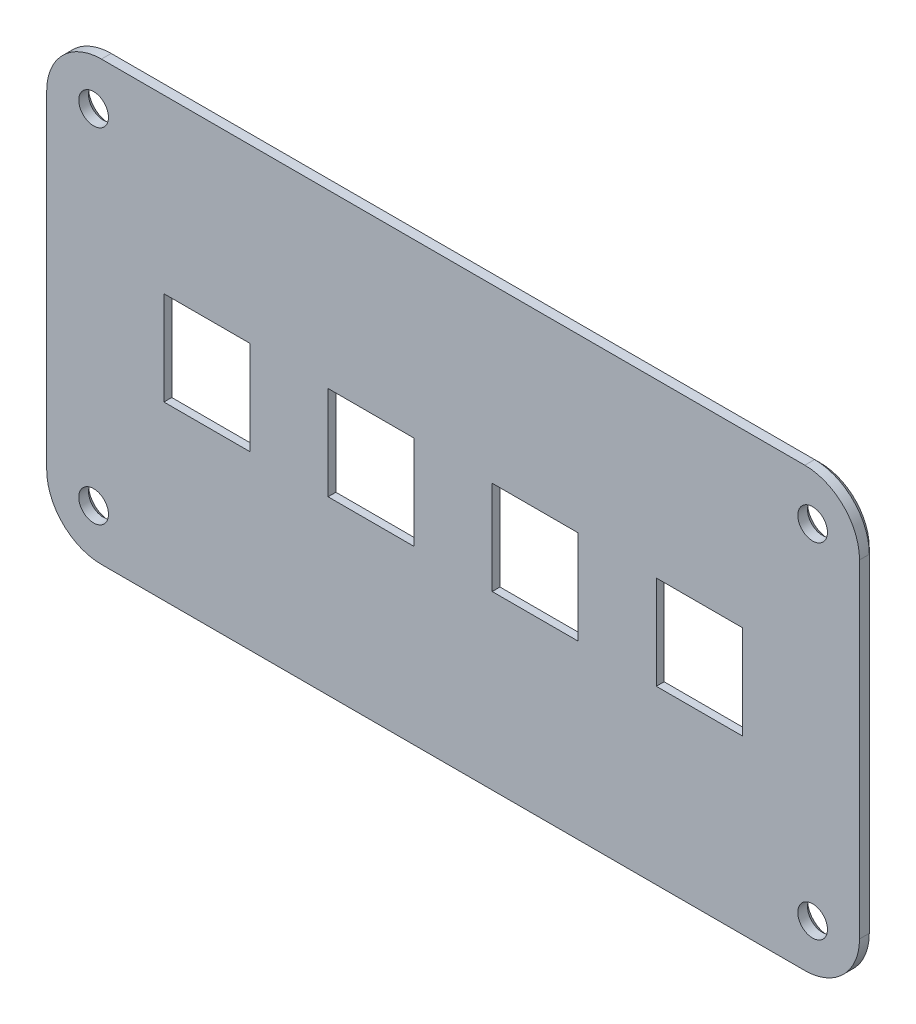
from build123d import *

# Parameters (mm, degrees)
SKETCH1_R           = 1.9
BOSS_EXTRUDE1_DEPTH = 2
CUT_EXTRUDE1_REACH  = 61.093
SKETCH2_W           = 11
SKETCH2_H           = 12
CHAMFER1_SIZE       = 1
BOSS_EXTRUDE2_DEPTH = 1
CHAMFER2_SIZE       = 0.75


with BuildPart() as part:
    # Sketch1 → Boss-Extrude1 (new body)
    with BuildSketch(Plane.XY):
        with BuildLine():
            Line((-52, 21), (-52, -21))
            ThreePointArc((-52, -21), (-49.949747468, -25.949747468), (-45, -28))
            Line((-45, -28), (45, -28))
            ThreePointArc((45, -28), (49.949747468, -25.949747468), (52, -21))
            Line((52, -21), (52, 21))
            ThreePointArc((52, 21), (49.949747468, 25.949747468), (45, 28))
            Line((45, 28), (-45, 28))
            ThreePointArc((-45, 28), (-49.949747468, 25.949747468), (-52, 21))
        make_face()
        with Locations((-46, 22)):
            Circle(SKETCH1_R, mode=Mode.SUBTRACT)
        with Locations((46, 22)):
            Circle(SKETCH1_R, mode=Mode.SUBTRACT)
        with Locations((46, -22)):
            Circle(SKETCH1_R, mode=Mode.SUBTRACT)
        with Locations(Location((-46, -22, 0), (0, 0, 180))):
            Circle(SKETCH1_R, mode=Mode.SUBTRACT)
    extrude(amount=BOSS_EXTRUDE1_DEPTH)

    # Sketch2 → Cut-Extrude1 (cut, up to next)
    with BuildSketch(Plane(origin=(0, 0, 0), x_dir=(-1, 0, 0), z_dir=(0, 0, -1)), mode=Mode.PRIVATE) as cut_extrude1_sk1:
        with Locations((-31.5, 0)):
            Rectangle(SKETCH2_W, SKETCH2_H)
    cut_extrude1_tool1 = extrude(cut_extrude1_sk1.sketch, amount=-CUT_EXTRUDE1_REACH, mode=Mode.PRIVATE) & part.part
    # Sketch2 → Cut-Extrude1 (cut, up to next)
    with BuildSketch(Plane(origin=(0, 0, 0), x_dir=(-1, 0, 0), z_dir=(0, 0, -1)), mode=Mode.PRIVATE) as cut_extrude1_sk2:
        with Locations((-10.5, 0)):
            Rectangle(SKETCH2_W, SKETCH2_H)
    cut_extrude1_tool2 = extrude(cut_extrude1_sk2.sketch, amount=-CUT_EXTRUDE1_REACH, mode=Mode.PRIVATE) & part.part
    # Sketch2 → Cut-Extrude1 (cut, up to next)
    with BuildSketch(Plane(origin=(0, 0, 0), x_dir=(-1, 0, 0), z_dir=(0, 0, -1)), mode=Mode.PRIVATE) as cut_extrude1_sk3:
        with Locations((10.5, 0)):
            Rectangle(SKETCH2_W, SKETCH2_H)
    cut_extrude1_tool3 = extrude(cut_extrude1_sk3.sketch, amount=-CUT_EXTRUDE1_REACH, mode=Mode.PRIVATE) & part.part
    # Sketch2 → Cut-Extrude1 (cut, up to next)
    with BuildSketch(Plane(origin=(0, 0, 0), x_dir=(-1, 0, 0), z_dir=(0, 0, -1)), mode=Mode.PRIVATE) as cut_extrude1_sk4:
        with Locations((31.5, 0)):
            Rectangle(SKETCH2_W, SKETCH2_H)
    cut_extrude1_tool4 = extrude(cut_extrude1_sk4.sketch, amount=-CUT_EXTRUDE1_REACH, mode=Mode.PRIVATE) & part.part
    add(cut_extrude1_tool1.solids().sort_by_distance((31.5, 0, 0))[0], mode=Mode.SUBTRACT)
    add(cut_extrude1_tool2.solids().sort_by_distance((10.5, 0, 0))[0], mode=Mode.SUBTRACT)
    add(cut_extrude1_tool3.solids().sort_by_distance((-10.5, 0, 0))[0], mode=Mode.SUBTRACT)
    add(cut_extrude1_tool4.solids().sort_by_distance((-31.5, 0, 0))[0], mode=Mode.SUBTRACT)

    # Chamfer1
    chamfer1_edges = [part.edges().sort_by_distance(p)[0] for p in [
        (26, 0, 0),
        (31.5, 6, 0),
        (37, 0, 0),
        (31.5, -6, 0),
        (5, 0, 0),
        (10.5, 6, 0),
        (16, 0, 0),
        (10.5, -6, 0),
        (-16, 0, 0),
        (-10.5, 6, 0),
        (-5, 0, 0),
        (-10.5, -6, 0),
        (-37, 0, 0),
        (-31.5, 6, 0),
        (-26, 0, 0),
        (-31.5, -6, 0),
    ]]
    chamfer(chamfer1_edges, length=CHAMFER1_SIZE)

    # Sketch3 → Boss-Extrude2 (add)
    # profile 1 of 4: a face of its own
    with BuildSketch(Plane(origin=(0, 0, 0), x_dir=(-1, 0, 0), z_dir=(0, 0, -1))):
        Polygon((-28.967105263, 13.376644737), (-33.866365132, 13.376644737), (-34.939555921, 11), (-36.711759868, 11), (-32.244243421, 21.131578947), (-30.574835526, 21.131578947), (-26.078536184, 11), (-27.893914474, 11), align=None)
        Polygon((-29.499588816, 14.815789474), (-31.415707237, 19.361430921), (-33.317434211, 14.815789474), align=None, mode=Mode.SUBTRACT)
    # profile 2 of 4: a face of its own
    with BuildSketch(Plane(origin=(0, 0, 0), x_dir=(-1, 0, 0), z_dir=(0, 0, -1))):
        with BuildLine():
            add(Edge.make_bspline(
                [(-7.465460526, 16.219983553), (-7.401377429, 16.204035917), (-7.273505586, 16.172213896), (-7.089337633, 16.103759799), (-6.913457497, 16.020947798), (-6.745530286, 15.924345618), (-6.587259947, 15.809702203), (-6.434906514, 15.683159241), (-6.291869612, 15.539902226), (-6.160285298, 15.381834349), (-6.035443673, 15.215341935), (-5.93112162, 15.034201512), (-5.840424563, 14.84545415), (-5.765585394, 14.647623537), (-5.710938372, 14.439917903), (-5.669361763, 14.22366773), (-5.644410682, 13.997430988), (-5.641354143, 13.843400363), (-5.639802632, 13.765213816)],
                knots=[0, 0, 0, 0, 0.956192746, 1.907993456, 2.840752042, 3.770599473, 4.710150656, 5.668711876, 6.637605253, 7.638136089, 8.647007689, 9.648326501, 10.660904689, 11.678920621, 12.707390369, 13.768694862, 14.867380783, 16, 16, 16, 16], degree=3))
            add(Edge.make_bspline(
                [(-5.639802632, 13.765213816), (-5.642984462, 13.660176236), (-5.649215288, 13.454486206), (-5.697437192, 13.154288649), (-5.776314623, 12.871173076), (-5.892411663, 12.607183093), (-6.035057199, 12.358679101), (-6.21535012, 12.131336949), (-6.424568665, 11.919871557), (-6.665989866, 11.726854913), (-6.93777738, 11.55352289), (-7.240491942, 11.407135309), (-7.568918759, 11.277696195), (-7.928158706, 11.176788668), (-8.315676849, 11.096985237), (-8.731828949, 11.03963763), (-9.176854868, 11.007719312), (-9.482954234, 11.002624382), (-9.640625, 11)],
                knots=[0, 0, 0, 0, 0.919277724, 1.80017725, 2.654857091, 3.485266342, 4.318834452, 5.156624496, 6.017913191, 6.918436248, 7.857225575, 8.83397997, 9.857969236, 10.944245806, 12.096291106, 13.31991079, 14.619494956, 16, 16, 16, 16], degree=3))
            Line((-9.640625, 11), (-14.430921053, 11))
            Line((-14.430921053, 11), (-14.430921053, 21.131578947))
            Line((-14.430921053, 21.131578947), (-9.920230263, 21.131578947))
            add(Edge.make_bspline(
                [(-9.920230263, 21.131578947), (-9.774904028, 21.128868733), (-9.492094601, 21.12359457), (-9.07962185, 21.092626141), (-8.693424093, 21.031552144), (-8.331070212, 20.953512343), (-7.996179871, 20.847561079), (-7.683917639, 20.723799485), (-7.400442667, 20.569735489), (-7.139786095, 20.398563911), (-6.910027923, 20.204054552), (-6.706774847, 19.997126019), (-6.53523803, 19.772416379), (-6.398232396, 19.530125666), (-6.286986307, 19.274394461), (-6.212436922, 19.001520839), (-6.162400026, 18.714291644), (-6.158057427, 18.516670711), (-6.155838816, 18.415707237)],
                knots=[0, 0, 0, 0, 1.336286475, 2.600455535, 3.798999959, 4.928674438, 6.004787893, 7.025056379, 8.011676755, 8.965813923, 9.887098281, 10.773799428, 11.628191274, 12.477690323, 13.327352918, 14.185037409, 15.072745346, 16, 16, 16, 16], degree=3))
            add(Edge.make_bspline(
                [(-6.155838816, 18.415707237), (-6.159819446, 18.287905241), (-6.16760867, 18.037824685), (-6.239310355, 17.674970927), (-6.356970182, 17.335377088), (-6.521020311, 17.025450308), (-6.718166496, 16.750986955), (-6.942087647, 16.521604663), (-7.189333692, 16.337663519), (-7.373817035, 16.259040253), (-7.465460526, 16.219983553)],
                knots=[0, 0, 0, 0, 1.128919966, 2.209049493, 3.25528948, 4.296006145, 5.298287809, 6.232298465, 7.121880943, 8, 8, 8, 8], degree=3))
        make_face()
        with BuildLine():
            Line((-12.640213816, 19.692434211), (-12.640213816, 16.789473684))
            Line((-12.640213816, 16.789473684), (-10.045641447, 16.789473684))
            add(Edge.make_bspline(
                [(-10.045641447, 16.789473684), (-9.962007853, 16.790763715), (-9.80005632, 16.793261783), (-9.564579474, 16.809450721), (-9.344708527, 16.837509147), (-9.140853522, 16.878869657), (-8.95222004, 16.929819125), (-8.779015213, 16.992815234), (-8.622080932, 17.069944602), (-8.478762382, 17.155332009), (-8.353155797, 17.254902973), (-8.242677928, 17.363526411), (-8.1520415, 17.485190104), (-8.074337603, 17.614433643), (-8.01738596, 17.757164139), (-7.973692481, 17.908437022), (-7.948919342, 18.071561529), (-7.945997469, 18.183306749), (-7.944490132, 18.240953947)],
                knots=[0, 0, 0, 0, 1.388404796, 2.688564191, 3.916271261, 5.065340991, 6.138999959, 7.157663944, 8.119334074, 9.03833356, 9.921420651, 10.774159163, 11.602412025, 12.433628792, 13.270277899, 14.145414394, 15.043255143, 16, 16, 16, 16], degree=3))
            add(Edge.make_bspline(
                [(-7.944490132, 18.240953947), (-7.946093763, 18.297902157), (-7.949239462, 18.40961229), (-7.973102858, 18.572234096), (-8.017785013, 18.723277674), (-8.074411848, 18.865336618), (-8.151810643, 18.995369895), (-8.244932366, 19.115648664), (-8.355072942, 19.225054244), (-8.480855048, 19.324499499), (-8.624136811, 19.409875883), (-8.781029105, 19.487195888), (-8.95463349, 19.549439037), (-9.142518244, 19.60375075), (-9.346826473, 19.644177075), (-9.56661731, 19.672522575), (-9.801433322, 19.688578102), (-9.962695265, 19.691124469), (-10.045641447, 19.692434211)],
                knots=[0, 0, 0, 0, 0.946116285, 1.855910409, 2.720779912, 3.558079771, 4.389943065, 5.225770781, 6.07917256, 6.962946522, 7.882660813, 8.845078938, 9.864535248, 10.942101456, 12.092064941, 13.320726931, 14.6218976, 16, 16, 16, 16], degree=3))
            Line((-10.045641447, 19.692434211), (-12.640213816, 19.692434211))
        make_face(mode=Mode.SUBTRACT)
        with BuildLine():
            add(Edge.make_bspline(
                [(-9.696134868, 12.439144737), (-9.603589932, 12.440383272), (-9.424517158, 12.442779814), (-9.165229294, 12.459573871), (-8.924103577, 12.485028812), (-8.701711791, 12.524274582), (-8.497700534, 12.573391014), (-8.311764021, 12.631422903), (-8.145947716, 12.704873012), (-7.996452779, 12.785958181), (-7.865507096, 12.881775066), (-7.751903137, 12.988590094), (-7.655243428, 13.107932297), (-7.57676062, 13.240084517), (-7.517184782, 13.385863812), (-7.474655133, 13.542627639), (-7.446456107, 13.711438466), (-7.444077185, 13.828141184), (-7.442845395, 13.888569079)],
                knots=[0, 0, 0, 0, 1.458937508, 2.823017607, 4.094897181, 5.279678661, 6.380284019, 7.40190255, 8.345345489, 9.235240217, 10.078043087, 10.895820527, 11.68719234, 12.491367394, 13.310000847, 14.161896001, 15.048241914, 16, 16, 16, 16], degree=3))
            add(Edge.make_bspline(
                [(-7.442845395, 13.888569079), (-7.444226508, 13.947597883), (-7.446923663, 14.062874262), (-7.473670294, 14.230191707), (-7.519923148, 14.384736649), (-7.578775009, 14.529975789), (-7.660120394, 14.661268406), (-7.757994106, 14.782403637), (-7.873663639, 14.891374121), (-8.007278068, 14.988738259), (-8.15752608, 15.074955326), (-8.326035974, 15.148791977), (-8.510922615, 15.21228086), (-8.714416981, 15.263977169), (-8.935299334, 15.301195737), (-9.173251615, 15.330819673), (-9.428656537, 15.3464442), (-9.604970774, 15.349004917), (-9.696134868, 15.350328947)],
                knots=[0, 0, 0, 0, 0.931219401, 1.818563043, 2.663976921, 3.473549635, 4.284205487, 5.091680015, 5.925668856, 6.784537713, 7.695497676, 8.654263813, 9.683872919, 10.777831551, 11.963946699, 13.217020784, 14.561047675, 16, 16, 16, 16], degree=3))
            Line((-9.696134868, 15.350328947), (-12.640213816, 15.350328947))
            Line((-12.640213816, 15.350328947), (-12.640213816, 12.439144737))
            Line((-12.640213816, 12.439144737), (-9.696134868, 12.439144737))
        make_face(mode=Mode.SUBTRACT)
    # profile 3 of 4: a face of its own
    with BuildSketch(Plane(origin=(0, 0, 0), x_dir=(-1, 0, 0), z_dir=(0, 0, -1))):
        with BuildLine():
            add(Edge.make_bspline(
                [(11.330592105, 10.868421053), (11.206462151, 10.870091442), (10.961179726, 10.873392154), (10.598976645, 10.908794519), (10.245618049, 10.958307933), (9.901939966, 11.033666923), (9.566081897, 11.126817392), (9.24103481, 11.246113193), (8.923104501, 11.380304248), (8.617566868, 11.539384592), (8.324804729, 11.715753338), (8.045170133, 11.906721427), (7.784718789, 12.117223378), (7.539540082, 12.34167689), (7.309218059, 12.580744968), (7.098864396, 12.839042743), (6.899762424, 13.109762218), (6.722166915, 13.398005813), (6.561264251, 13.697668935), (6.422222595, 14.008543986), (6.300770074, 14.327562234), (6.208289026, 14.658570509), (6.130598657, 14.997140858), (6.078629554, 15.345654293), (6.04373978, 15.702547592), (6.040361337, 15.94371898), (6.038651316, 16.065789474)],
                knots=[0, 0, 0, 0, 1.077073096, 2.128310629, 3.156302052, 4.17250584, 5.179967175, 6.179105447, 7.175743897, 8.173411401, 9.166012089, 10.141152415, 11.110086289, 12.070013113, 13.025043404, 13.988502359, 14.959387984, 15.939865835, 16.92450304, 17.909589339, 18.894028878, 19.884327642, 20.890189678, 21.907298367, 22.940765217, 24, 24, 24, 24], degree=3))
            add(Edge.make_bspline(
                [(6.038651316, 16.065789474), (6.040381568, 16.187854869), (6.04379998, 16.429016183), (6.078397112, 16.785983239), (6.131328457, 17.13341465), (6.204691986, 17.471745528), (6.30256802, 17.799570062), (6.419271662, 18.11949854), (6.559649364, 18.429588105), (6.719512801, 18.730263252), (6.900504595, 19.016273213), (7.096247239, 19.289888619), (7.310103759, 19.546725803), (7.540930542, 19.787058803), (7.786202176, 20.013220461), (8.05075042, 20.220222983), (8.330227258, 20.414177483), (8.625851965, 20.590208206), (8.933975811, 20.748523882), (9.252359295, 20.886806343), (9.580823187, 21.000933442), (9.915846722, 21.098849152), (10.260091295, 21.173005262), (10.61334572, 21.222857326), (10.974894256, 21.258101568), (11.219485788, 21.261461955), (11.342927632, 21.263157895)],
                knots=[0, 0, 0, 0, 1.058115815, 2.090490919, 3.106525142, 4.104236408, 5.089447522, 6.070780403, 7.054826064, 8.038423107, 9.021014499, 9.987391445, 10.953622231, 11.916045052, 12.874957817, 13.843816119, 14.826191881, 15.822840885, 16.824737074, 17.828129931, 18.829814645, 19.837841812, 20.85297209, 21.87987755, 22.930004564, 24, 24, 24, 24], degree=3))
            add(Edge.make_bspline(
                [(11.342927632, 21.263157895), (11.541201573, 21.258518702), (11.930949872, 21.249399412), (12.502663234, 21.174581598), (13.0486456, 21.047850672), (13.484781947, 20.90437213), (13.819034948, 20.764407438), (14.059470015, 20.644565668), (14.292186922, 20.512904215), (14.516309176, 20.369278482), (14.730631636, 20.212847436), (14.93519461, 20.04251883), (15.132692944, 19.861085833), (15.255479253, 19.729570372), (15.317023026, 19.663651316)],
                knots=[0, 0, 0, 0, 1.616490245, 3.177544758, 4.691801435, 6.181605177, 6.915434397, 7.645230561, 8.370992775, 9.09494532, 9.814809477, 10.533218725, 11.264810103, 12, 12, 12, 12], degree=3))
            Line((15.317023026, 19.663651316), (14.186266447, 18.623355263))
            add(Edge.make_bspline(
                [(14.186266447, 18.623355263), (14.085840221, 18.71915187), (13.888459881, 18.907433035), (13.568223132, 19.152742191), (13.235855238, 19.359069515), (12.892151861, 19.5299887), (12.535545065, 19.661273242), (12.167993178, 19.756640174), (11.788114341, 19.813683433), (11.530896003, 19.820538055), (11.400493421, 19.824013158)],
                knots=[0, 0, 0, 0, 1.068128898, 2.099328572, 3.099478003, 4.076515181, 5.049911612, 6.020084275, 6.996237502, 8, 8, 8, 8], degree=3))
            add(Edge.make_bspline(
                [(11.400493421, 19.824013158), (11.318912667, 19.822056376), (11.156875264, 19.818169774), (10.916951169, 19.798626601), (10.682950598, 19.760611527), (10.454295847, 19.709213786), (10.230800994, 19.644105382), (10.013398587, 19.562831941), (9.801673849, 19.468530254), (9.59604138, 19.359732093), (9.398972143, 19.236551009), (9.212193653, 19.100328088), (9.033551784, 18.954312282), (8.867443387, 18.793267842), (8.710757703, 18.620270326), (8.564581747, 18.434717658), (8.428728811, 18.236858048), (8.303640358, 18.027499895), (8.190688407, 17.80888875), (8.093769674, 17.581215982), (8.011950574, 17.346873829), (7.943042998, 17.105538181), (7.892375478, 16.855874735), (7.855623128, 16.599133488), (7.832294938, 16.334855559), (7.828981946, 16.156298039), (7.827302632, 16.065789474)],
                knots=[0, 0, 0, 0, 1.012681514, 2.011409221, 2.984605179, 3.952322499, 4.918506223, 5.871156184, 6.830578041, 7.793161347, 8.756007639, 9.71210629, 10.660608898, 11.617010136, 12.580457268, 13.555435502, 14.546273465, 15.557096059, 16.58033014, 17.597715197, 18.625252601, 19.659176428, 20.710032751, 21.78413949, 22.876808126, 24, 24, 24, 24], degree=3))
            add(Edge.make_bspline(
                [(7.827302632, 16.065789474), (7.828982128, 15.975277115), (7.832308152, 15.796029225), (7.855764366, 15.531128815), (7.891370447, 15.273266674), (7.946966765, 15.024121463), (8.010118345, 14.78030183), (8.096686184, 14.546777317), (8.192464088, 14.318476532), (8.30586489, 14.100059079), (8.430108658, 13.890833506), (8.567322096, 13.694588891), (8.712746009, 13.509217939), (8.86944111, 13.336172677), (9.035524237, 13.175937458), (9.212305013, 13.028504223), (9.399056989, 12.893072777), (9.596021272, 12.769773153), (9.801669201, 12.66096291), (10.013436961, 12.566827329), (10.229857041, 12.485203262), (10.453212417, 12.422684774), (10.681501494, 12.370586616), (10.916307353, 12.333178102), (11.156867216, 12.313365477), (11.318909972, 12.309507939), (11.400493421, 12.307565789)],
                knots=[0, 0, 0, 0, 1.123036233, 2.224026416, 3.297984316, 4.350448643, 5.390158288, 6.420400109, 7.437644186, 8.460736477, 9.471419002, 10.455123854, 11.429966985, 12.393280611, 13.34954932, 14.291378211, 15.247344375, 16.210057245, 17.172507166, 18.131796075, 19.084314028, 20.039826195, 21.007409418, 21.9888695, 22.987458813, 24, 24, 24, 24], degree=3))
            add(Edge.make_bspline(
                [(11.400493421, 12.307565789), (11.529565102, 12.310845025), (11.78559245, 12.317349735), (12.163574719, 12.377944222), (12.531443505, 12.47110675), (12.885892938, 12.607005404), (13.231369355, 12.77627633), (13.563420114, 12.987568662), (13.886519608, 13.234248682), (14.085192298, 13.424015764), (14.186266447, 13.520559211)],
                knots=[0, 0, 0, 0, 0.991723628, 1.967188853, 2.935899518, 3.904739145, 4.88030398, 5.889001308, 6.926035599, 8, 8, 8, 8], degree=3))
            Line((14.186266447, 13.520559211), (15.317023026, 12.478207237))
            add(Edge.make_bspline(
                [(15.317023026, 12.478207237), (15.255487575, 12.412277458), (15.13271787, 12.280740605), (14.934384554, 12.098813693), (14.729498848, 11.927321638), (14.513597074, 11.770847207), (14.290789436, 11.624517119), (14.057356781, 11.493244264), (13.816066435, 11.373199761), (13.480949099, 11.230794756), (13.042798001, 11.085231339), (12.494210633, 10.959853633), (11.920854064, 10.88143899), (11.52958496, 10.872809742), (11.330592105, 10.868421053)],
                knots=[0, 0, 0, 0, 0.732589279, 1.461592769, 2.185302107, 2.902619859, 3.627035893, 4.350230838, 5.077445464, 5.815979368, 7.307557206, 8.82188381, 10.383663803, 12, 12, 12, 12], degree=3))
        make_face()
    # profile 4 of 4: a face of its own
    with BuildSketch(Plane(origin=(0, 0, 0), x_dir=(-1, 0, 0), z_dir=(0, 0, -1))):
        with BuildLine():
            Line((27.108552632, 21.131578947), (31.356085526, 21.131578947))
            add(Edge.make_bspline(
                [(31.356085526, 21.131578947), (31.490464444, 21.129642215), (31.756154732, 21.125812963), (32.14877285, 21.094253866), (32.53039892, 21.042997125), (32.899950429, 20.971742906), (33.258124803, 20.878171564), (33.605147017, 20.765767205), (33.94112363, 20.632083272), (34.263078296, 20.477366743), (34.571487337, 20.307818372), (34.862182934, 20.120398461), (35.133756933, 19.916459794), (35.387334216, 19.698161522), (35.622982709, 19.465205989), (35.839478049, 19.215709393), (36.03664253, 18.949962398), (36.215822666, 18.670659355), (36.373252344, 18.378721975), (36.512627733, 18.07704922), (36.628360301, 17.765239621), (36.726843296, 17.444479572), (36.800401388, 17.113733996), (36.850358063, 16.772802503), (36.885636369, 16.422884236), (36.888948332, 16.185808272), (36.890625, 16.065789474)],
                knots=[0, 0, 0, 0, 1.148415491, 2.270615411, 3.3640759, 4.438146552, 5.485189072, 6.526184972, 7.554046844, 8.573193319, 9.57733295, 10.56028753, 11.526751455, 12.477828262, 13.41802075, 14.356405192, 15.298274773, 16.243925081, 17.190083178, 18.131005205, 19.081865547, 20.0305766, 20.996898518, 21.974392975, 22.974544207, 24, 24, 24, 24], degree=3))
            add(Edge.make_bspline(
                [(36.890625, 16.065789474), (36.888967005, 15.945766965), (36.885691928, 15.708683671), (36.850075686, 15.358144197), (36.801068669, 15.017012105), (36.725650464, 14.685384391), (36.629783233, 14.363809601), (36.511487616, 14.051568652), (36.373942297, 13.749116786), (36.215624243, 13.456924385), (36.037337245, 13.177679262), (35.838766069, 12.913655985), (35.623060239, 12.664270449), (35.387376823, 12.431289444), (35.133918655, 12.21376222), (34.864062463, 12.008447453), (34.573462231, 11.821817063), (34.265165632, 11.65209775), (33.943136185, 11.497560873), (33.608148537, 11.363645389), (33.260665797, 11.253270629), (32.902646902, 11.160037538), (32.53245793, 11.088560842), (32.150827946, 11.037331289), (31.757527368, 11.005707832), (31.491150384, 11.001920396), (31.356085526, 11)],
                knots=[0, 0, 0, 0, 1.025203116, 2.025107906, 3.008151727, 3.968521596, 4.928212797, 5.873358016, 6.819373601, 7.765298561, 8.710715855, 9.647662069, 10.585815288, 11.525776108, 12.476618565, 13.438166037, 14.420878412, 15.424770618, 16.44366597, 17.471274571, 18.504640129, 19.557093011, 20.630899006, 21.724090061, 22.846013466, 24, 24, 24, 24], degree=3))
            Line((31.356085526, 11), (27.108552632, 11))
            Line((27.108552632, 11), (27.108552632, 21.131578947))
        make_face()
        with BuildLine():
            add(Edge.make_bspline(
                [(31.271792763, 12.439144737), (31.36642228, 12.439905125), (31.55322573, 12.441406168), (31.828921104, 12.46606243), (32.096107352, 12.49964707), (32.353644676, 12.549025084), (32.602054133, 12.613395148), (32.841997518, 12.690819083), (33.072904796, 12.783390322), (33.292971113, 12.890733384), (33.503133959, 13.010145645), (33.702106025, 13.140737793), (33.887807821, 13.284321963), (34.063552349, 13.435325056), (34.224507065, 13.60102794), (34.371937561, 13.778839693), (34.511262971, 13.965230995), (34.633544946, 14.165840304), (34.744917219, 14.37391107), (34.839384073, 14.592426776), (34.922521812, 14.817680431), (34.987305354, 15.052499034), (35.039017158, 15.29410468), (35.07663834, 15.543945075), (35.096180742, 15.802318335), (35.100029317, 15.977356897), (35.101973684, 16.065789474)],
                knots=[0, 0, 0, 0, 1.145881131, 2.262027276, 3.350413886, 4.407058139, 5.435945018, 6.457167578, 7.459179194, 8.446781597, 9.420858651, 10.385587306, 11.327032957, 12.262604153, 13.190148674, 14.121252701, 15.059361767, 16.006208841, 16.96430698, 17.915945674, 18.887614272, 19.870565323, 20.863769165, 21.87930732, 22.928588565, 24, 24, 24, 24], degree=3))
            add(Edge.make_bspline(
                [(35.101973684, 16.065789474), (35.100047643, 16.154222796), (35.09625022, 16.3285798), (35.076550323, 16.586262501), (35.038727344, 16.836040878), (34.987870468, 17.077837738), (34.922614722, 17.311925027), (34.838360982, 17.53598067), (34.746085146, 17.754804654), (34.632856804, 17.961956978), (34.511337124, 18.16226244), (34.372008484, 18.348705763), (34.223838338, 18.526481147), (34.064203782, 18.694111955), (33.88762844, 18.845913132), (33.700442742, 18.98739349), (33.502589421, 19.12068209), (33.290770388, 19.238644359), (33.069296357, 19.34572452), (32.83849244, 19.438488348), (32.599091266, 19.51587664), (32.351929046, 19.583177006), (32.094005061, 19.631760228), (31.827552118, 19.66543309), (31.552544726, 19.690238949), (31.366423035, 19.691694275), (31.271792763, 19.692434211)],
                knots=[0, 0, 0, 0, 1.07183021, 2.113243049, 3.12917814, 4.13089313, 5.106235226, 6.070483022, 7.030106274, 7.98124718, 8.928464341, 9.866940079, 10.798408039, 11.732279315, 12.668216191, 13.616633996, 14.574818748, 15.55650437, 16.551968832, 17.554372096, 18.568098445, 19.599496027, 20.656553283, 21.745365303, 22.853670987, 24, 24, 24, 24], degree=3))
            Line((31.271792763, 19.692434211), (28.899259868, 19.692434211))
            Line((28.899259868, 19.692434211), (28.899259868, 12.439144737))
            Line((28.899259868, 12.439144737), (31.271792763, 12.439144737))
        make_face(mode=Mode.SUBTRACT)
    extrude(amount=BOSS_EXTRUDE2_DEPTH)

    # Chamfer2
    chamfer2_edges = [part.edges().sort_by_distance(p)[0] for p in [
        (-49.949747468, 25.949747468, 0),
        (0, 28, 0),
        (-47.9, 22, 0),
        (-44.1, -22, 0),
        (44.1, -22, 0),
        (44.1, 22, 0),
        (49.949747468, 25.949747468, 0),
        (52, 0, 0),
        (49.949747468, -25.949747468, 0),
        (0, -28, 0),
        (-49.949747468, -25.949747468, 0),
        (-52, 0, 0),
    ]]
    chamfer(chamfer2_edges, length=CHAMFER2_SIZE)


solid = part.part
